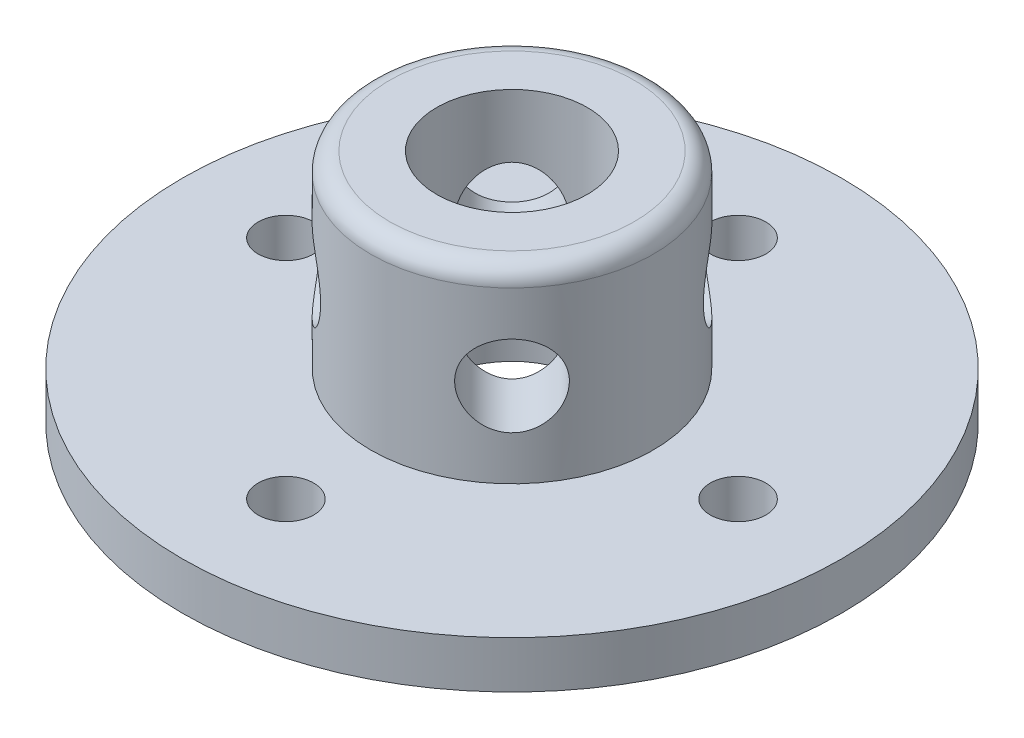
from build123d import *

# Parameters (mm, degrees)
SKETCH2_R           = 17.5
SKETCH2_R_2         = 1.475
SKETCH2_R_3         = 4
BOSS_EXTRUDE1_DEPTH = 2.5
SKETCH3_R           = 7.5
SKETCH3_R_2         = 4
BOSS_EXTRUDE2_DEPTH = 10
FILLET1_R           = 1
SKETCH7_R           = 2.153442821
CUT_EXTRUDE7_DEPTH  = 5
CIRPATTERN2_COUNT   = 4


with BuildPart() as part:
    # Sketch2 → Boss-Extrude1 (new body)
    with BuildSketch(Plane(origin=(0, 0, 0), x_dir=(1, 0, 0), z_dir=(0, 1, 0))):
        with Locations(Location((0, 0, 0), (0, 0, 270))):
            Circle(SKETCH2_R)
        with Locations(Location((-12, 0, 0), (0, 0, 270))):
            Circle(SKETCH2_R_2, mode=Mode.SUBTRACT)
        with Locations(Location((0, -12, 0), (0, 0, 270))):
            Circle(SKETCH2_R_2, mode=Mode.SUBTRACT)
        with Locations(Location((12, 0, 0), (0, 0, 270))):
            Circle(SKETCH2_R_2, mode=Mode.SUBTRACT)
        with Locations(Location((0, 12, 0), (0, 0, 270))):
            Circle(SKETCH2_R_2, mode=Mode.SUBTRACT)
        with Locations(Location((0, 0, 0), (0, 0, 270))):
            Circle(SKETCH2_R_3, mode=Mode.SUBTRACT)
    extrude(amount=BOSS_EXTRUDE1_DEPTH)

    # Sketch3 → Boss-Extrude2 (add)
    with BuildSketch(Plane(origin=(0, 2.5, 0), x_dir=(1, 0, 0), z_dir=(0, 1, 0))):
        with Locations(Location((0, 0, 0), (0, 0, 270))):
            Circle(SKETCH3_R)
        with Locations(Location((0, 0, 0), (0, 0, 270))):
            Circle(SKETCH3_R_2, mode=Mode.SUBTRACT)
    extrude(amount=BOSS_EXTRUDE2_DEPTH)

    # Fillet1
    fillet1_edges = [part.edges().sort_by_distance(p)[0] for p in [
        (0, 12.5, -7.5),
    ]]
    fillet(fillet1_edges, radius=FILLET1_R)

    # Sketch7 → Cut-Extrude7 (cut)
    with BuildSketch(Plane(origin=(5.303300859, 0, 5.303300859), x_dir=(0, -1, 0), z_dir=(0.7071067811865464, 0, 0.7071067811865488))):
        with Locations(Location((-7, 0, 0), (0, 0, 90))):
            Circle(SKETCH7_R)
    cut_extrude7 = extrude(amount=-CUT_EXTRUDE7_DEPTH, mode=Mode.SUBTRACT)

    # CirPattern2: Cut-Extrude7 ×4 about axis
    cirpattern2_axis = Axis((0, 12.5, 0), (0, -1, 0))
    for i in range(1, CIRPATTERN2_COUNT):
        add(cut_extrude7.rotate(cirpattern2_axis, i * 360 / CIRPATTERN2_COUNT), mode=Mode.SUBTRACT)


solid = part.part
